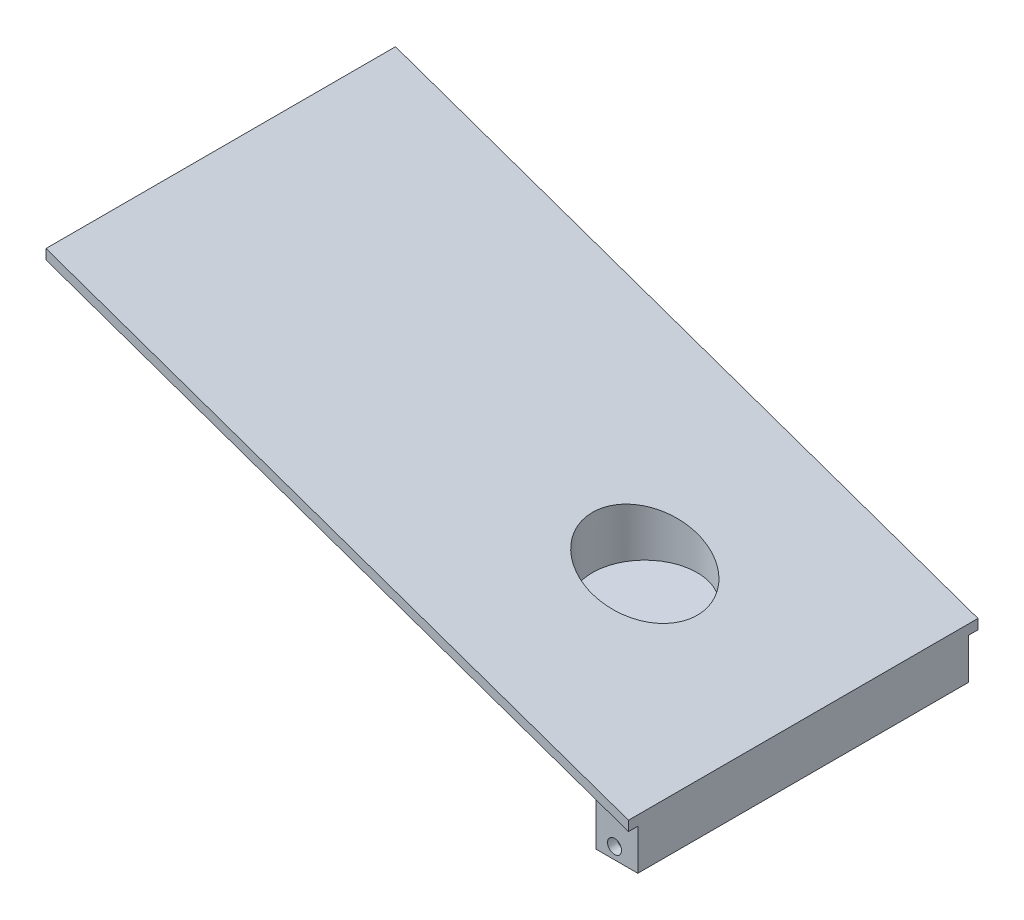
from build123d import *

# Parameters (mm, degrees)
BOSS_EXTRUDE1_DEPTH = 150
CUT_EXTRUDE1_DEPTH  = 4
CUT_EXTRUDE2_DEPTH  = 4
SKETCH4_R           = 3
CUT_EXTRUDE3_DEPTH  = 162
SKETCH6_W           = 134
SKETCH6_H           = 17.5
CUT_EXTRUDE4_DEPTH  = 14
SKETCH9_R           = 22.5
CUT_EXTRUDE5_DEPTH  = 83
SKETCH10_R          = 26.5
BOSS_EXTRUDE2_DEPTH = 55
SKETCH12_R          = 26.5
CUT_EXTRUDE6_DEPTH  = 27
SKETCH13_R          = 22.5
CUT_EXTRUDE7_DEPTH  = 24
SKETCH14_W          = 65
SKETCH14_H          = 142
CUT_EXTRUDE8_DEPTH  = 2
SKETCH15_W          = 73.049040635
SKETCH15_H          = 56.643959476
CUT_EXTRUDE9_DEPTH  = 22


with BuildPart() as part:
    # Sketch1 → Boss-Extrude1 (new body)
    with BuildSketch(Plane.XY):
        Polygon((0, 0), (0, 21.74), (-249.999833435, 109.239715329), (-249.999833435, 104.999731628), (-18, 23.8), (-18, 0), align=None)
    extrude(amount=BOSS_EXTRUDE1_DEPTH)

    # Sketch2 → Cut-Extrude1 (cut)
    with BuildSketch(Plane.XY.offset(150)):
        Polygon((-18, 23.8), (0, 17.500016299), (0, 0), (-18, 0), align=None)
    extrude(amount=-CUT_EXTRUDE1_DEPTH, mode=Mode.SUBTRACT)

    # Sketch3 → Cut-Extrude2 (cut)
    with BuildSketch(Plane(origin=(0, 0, 0), x_dir=(-1, 0, 0), z_dir=(0, 0, -1))):
        Polygon((18, 0), (18, 23.8), (0, 17.500016299), (0, 0), align=None)
    extrude(amount=-CUT_EXTRUDE2_DEPTH, mode=Mode.SUBTRACT)

    # Sketch4 → Cut-Extrude3 (cut)
    with BuildSketch(Plane(origin=(0, 0, 4), x_dir=(-1, 0, 0), z_dir=(0, 0, -1))):
        with Locations((10, 5)):
            Circle(SKETCH4_R)
    extrude(amount=-CUT_EXTRUDE3_DEPTH, mode=Mode.SUBTRACT)

    # Sketch6 → Cut-Extrude4 (cut)
    with BuildSketch(Plane.ZY.offset(18)):
        with Locations((75, 8.75)):
            Rectangle(SKETCH6_W, SKETCH6_H)
    extrude(amount=-CUT_EXTRUDE4_DEPTH, mode=Mode.SUBTRACT)

    # Sketch9 → Cut-Extrude5 (cut)
    with BuildSketch(Plane(origin=(0, 0, 0), x_dir=(1, 0, 0), z_dir=(0, 1, 0))):
        with Locations((-68, -75)):
            Circle(SKETCH9_R)
    extrude(amount=CUT_EXTRUDE5_DEPTH, mode=Mode.SUBTRACT)

    # Sketch10 → Boss-Extrude2 (add)
    with BuildSketch(Plane(origin=(0, 0, 0), x_dir=(1, 0, 0), z_dir=(0, 1, 0))):
        with Locations((-68, -75)):
            Circle(SKETCH10_R)
    extrude(amount=BOSS_EXTRUDE2_DEPTH)

    # Sketch12 → Cut-Extrude6 (cut)
    with BuildSketch(Plane.XZ):
        with Locations(Location((-68, 75, 0), (0, 0, 270))):
            Circle(SKETCH12_R)
    extrude(amount=-CUT_EXTRUDE6_DEPTH, mode=Mode.SUBTRACT)

    # Sketch13 → Cut-Extrude7 (cut)
    with BuildSketch(Plane(origin=(0, 55, 0), x_dir=(1, 0, 0), z_dir=(0, 1, 0))):
        with Locations(Location((-68, -75, 0), (0, 0, 270))):
            Circle(SKETCH13_R)
    extrude(amount=-CUT_EXTRUDE7_DEPTH, mode=Mode.SUBTRACT)

    # Sketch14 → Cut-Extrude8 (cut)
    with BuildSketch(Plane(origin=(5.456564202, 15.590223769, 0), x_dir=(0.9438586228518121, -0.3303496633391366, 0), z_dir=(-0.3303496633391366, -0.9438586228518121, 0))):
        with Locations((-234.151124493, 75)):
            Rectangle(SKETCH14_W, SKETCH14_H)
    extrude(amount=-CUT_EXTRUDE8_DEPTH, mode=Mode.SUBTRACT)

    # Sketch15 → Cut-Extrude9 (cut)
    with BuildSketch(Plane(origin=(6.778605444, 19.367494233, 0), x_dir=(0.9438586228518122, -0.330349663339136, 0), z_dir=(0.330349663339136, 0.9438586228518122, 0))):
        with Locations((-76.286643032, -75.675013618)):
            Rectangle(SKETCH15_W, SKETCH15_H)
    extrude(amount=CUT_EXTRUDE9_DEPTH, mode=Mode.SUBTRACT)


solid = part.part
